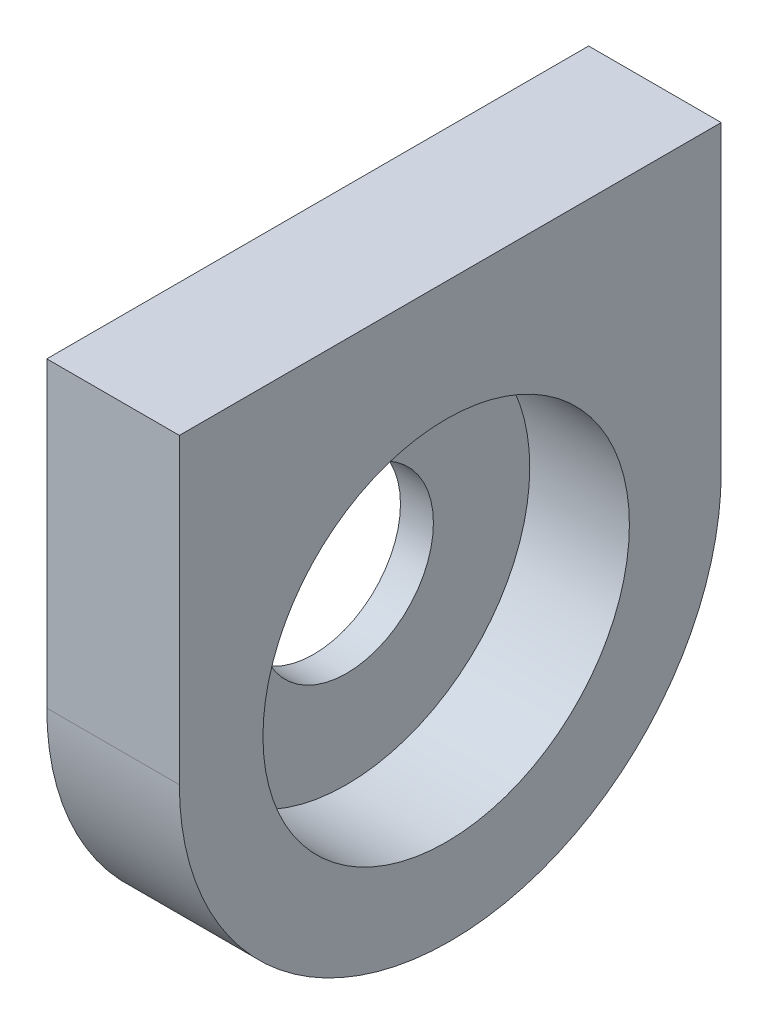
from build123d import *

# Parameters (mm, degrees)
CROQUIS1_R              = 5.275
SALIENTE_EXTRUIR1_DEPTH = 2
CROQUIS2_R              = 11.125
SALIENTE_EXTRUIR2_DEPTH = 6.05


with BuildPart() as part:
    # Croquis1 → Saliente-Extruir1 (new body)
    with BuildSketch(Plane(origin=(0, 0, 0), x_dir=(0, 0, -1), z_dir=(1, 0, 0))):
        with BuildLine():
            Line((60.7, 3.36816026), (60.7, 0))
            Line((60.7, 0), (60.7, -15))
            ThreePointArc((60.7, -15), (77.15, -31.45), (93.6, -15))
            Line((93.6, -15), (93.6, 0))
            Line((93.6, 0), (93.6, 3.36816026))
            Line((93.6, 3.36816026), (60.7, 3.36816026))
        make_face()
        with Locations((76.9, -15)):
            Circle(CROQUIS1_R, mode=Mode.SUBTRACT)
    extrude(amount=SALIENTE_EXTRUIR1_DEPTH)

    # Croquis2 → Saliente-Extruir2 (add)
    with BuildSketch(Plane(origin=(2, 0, 0), x_dir=(0, 0, -1), z_dir=(1, 0, 0))):
        with BuildLine():
            Line((93.6, -15), (93.6, 3.36816026))
            Line((93.6, 3.36816026), (60.7, 3.36816026))
            Line((60.7, 3.36816026), (60.7, -15))
            ThreePointArc((60.7, -15), (77.15, -31.45), (93.6, -15))
        make_face()
        with Locations((76.9, -15)):
            Circle(CROQUIS2_R, mode=Mode.SUBTRACT)
    extrude(amount=SALIENTE_EXTRUIR2_DEPTH)


solid = part.part
